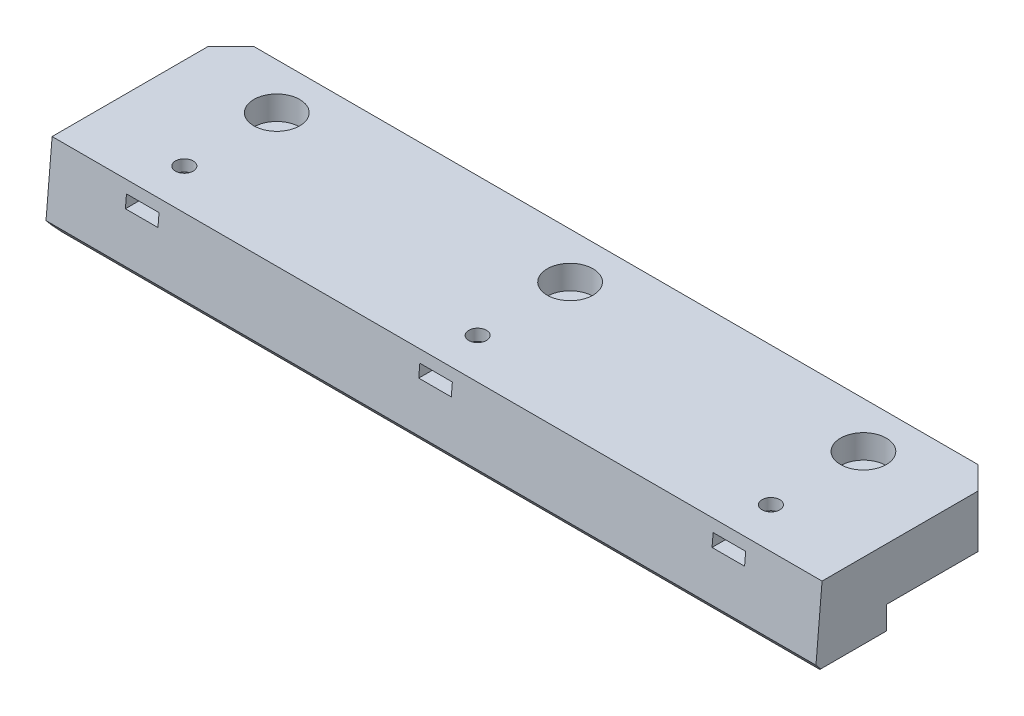
from build123d import *

# Parameters (mm, degrees)
SKETCH1_W             = 25.4
SKETCH1_H             = 9.525
BOSS_EXTRUDE1_DEPTH   = 106.68
BOSS_EXTRUDE2_DEPTH   = 213.36
CHAMFER1_SIZE         = 6.35
CHAMFER2_SIZE         = 3.175
CHAMFER2_SIZE2        = 2.93072295
F_8_CLEARANCE_HOLE1_D = 4.9149
CHAMFER3_SIZE         = 1.5875
BOSS_EXTRUDE3_DEPTH   = 3.429
BOSS_EXTRUDE4_START   = 3.175
SKETCH6_W             = 15.367
SKETCH6_H             = 20.192862299
SKETCH6_R             = 2.45745
BOSS_EXTRUDE4_DEPTH   = 3.175
SKETCH7_R             = 6.35
BOSS_EXTRUDE5_DEPTH   = 6.604
CUT_EXTRUDE1_DEPTH    = 218.112793351


with BuildPart() as part:
    # Sketch1 → Boss-Extrude1 (new, symmetric)
    with BuildSketch(Plane(origin=(0, 0, 0), x_dir=(0, 0, -1), z_dir=(1, 0, 0))):
        Rectangle(SKETCH1_W, SKETCH1_H)
    extrude(amount=BOSS_EXTRUDE1_DEPTH, both=True)

    # Sketch2 → Boss-Extrude2 (add, through all)
    with BuildSketch(Plane.ZY.offset(106.68)):
        Polygon((12.7, 4.7625), (37.438033761, 4.7625), (38.828997162, -11.13628443), (12.7, -11.13628443), align=None)
    extrude(amount=-BOSS_EXTRUDE2_DEPTH)

    # Chamfer1
    chamfer1_edges = [part.edges().sort_by_distance(p)[0] for p in [
        (106.68, 0, -12.7),
        (106.68, -7.949392215, 12.7),
        (-106.68, -7.949392215, 12.7),
        (-106.68, 0, -12.7),
    ]]
    chamfer(chamfer1_edges, length=CHAMFER1_SIZE)

    # Chamfer2
    chamfer2_edges = [part.edges().sort_by_distance(p)[0] for p in [
        (0, -11.13628443, 38.828997162),
    ]]
    chamfer2_side = [part.faces().sort_by_distance(p)[0] for p in [
        (0, -3.186892215, 38.133515462),
    ]]
    chamfer(chamfer2_edges, length=CHAMFER2_SIZE, length2=CHAMFER2_SIZE2, reference=chamfer2_side[0])

    # #8 Clearance Hole1 (through all)
    with Locations(Plane(origin=(0, -11.13628443, 0), x_dir=(-1, 0, 0), z_dir=(0, -1, 0))):
        with Locations((-81.28, -25.62613884), (0, 0), (0, -25.62613884), (81.28, -25.62613884), (81.28, 0), (-81.28, 0)):
            Hole(F_8_CLEARANCE_HOLE1_D / 2)

    # Chamfer3
    chamfer3_edges = [part.edges().sort_by_distance(p)[0] for p in [
        (0, -11.13628443, 12.7),
        (-106.68, -11.13628443, 27.474137106),
        (106.68, -11.13628443, 27.474137106),
        (-103.505, -11.13628443, 15.875),
        (103.505, -11.13628443, 15.875),
        (0, -4.7625, -12.7),
        (-103.505, -4.7625, -9.525),
        (103.505, -4.7625, -9.525),
        (-106.68, -4.7625, 6.35),
        (106.68, -4.7625, 6.35),
    ]]
    chamfer(chamfer3_edges, length=CHAMFER3_SIZE)

    # Sketch5 → Boss-Extrude3 (add)
    with BuildSketch(Plane(origin=(0, 4.7625, 0), x_dir=(1, 0, 0), z_dir=(0, 1, 0))):
        Polygon((85.7885, -37.438033761), (85.7885, -23.023155151), (81.28, -20.420171462), (76.7715, -23.023155151), (76.7715, -37.438033761), (73.5965, -37.438033761), (73.5965, -17.245171462), (88.9635, -17.245171462), (88.9635, -37.438033761), align=None)
        Polygon((4.5085, -37.438033761), (4.5085, -23.023155151), (0, -20.420171462), (-4.5085, -23.023155151), (-4.5085, -37.438033761), (-7.6835, -37.438033761), (-7.6835, -17.245171462), (7.6835, -17.245171462), (7.6835, -37.438033761), align=None)
        Polygon((-76.7715, -37.438033761), (-76.7715, -23.023155151), (-81.28, -20.420171462), (-85.7885, -23.023155151), (-85.7885, -37.438033761), (-88.9635, -37.438033761), (-88.9635, -17.245171462), (-73.5965, -17.245171462), (-73.5965, -37.438033761), align=None)
    extrude(amount=BOSS_EXTRUDE3_DEPTH)

    # Sketch6 → Boss-Extrude4 (add)
    # profile 1 of 3: a face of its own
    with BuildSketch(Plane(origin=(0, 8.1915, 0), x_dir=(1, 0, 0), z_dir=(0, 1, 0)).offset(BOSS_EXTRUDE4_START)):
        with Locations((-81.28, -27.341602612)):
            Rectangle(SKETCH6_W, SKETCH6_H)
        with Locations(Location((-81.28, -25.62613884, 0), (0, 0, 90))):
            Circle(SKETCH6_R, mode=Mode.SUBTRACT)
    # profile 2 of 3: a face of its own
    with BuildSketch(Plane(origin=(0, 8.1915, 0), x_dir=(1, 0, 0), z_dir=(0, 1, 0)).offset(BOSS_EXTRUDE4_START)):
        with Locations((0, -27.341602612)):
            Rectangle(SKETCH6_W, SKETCH6_H)
        with Locations(Location((0, -25.62613884, 0), (0, 0, 90))):
            Circle(SKETCH6_R, mode=Mode.SUBTRACT)
    # profile 3 of 3: a face of its own
    with BuildSketch(Plane(origin=(0, 8.1915, 0), x_dir=(1, 0, 0), z_dir=(0, 1, 0)).offset(BOSS_EXTRUDE4_START)):
        with Locations((81.28, -27.341602612)):
            Rectangle(SKETCH6_W, SKETCH6_H)
        with Locations(Location((81.28, -25.62613884, 0), (0, 0, 90))):
            Circle(SKETCH6_R, mode=Mode.SUBTRACT)
    extrude(amount=-BOSS_EXTRUDE4_DEPTH)

    # Sketch7 → Boss-Extrude5 (add)
    with BuildSketch(Plane(origin=(0, 4.7625, 0), x_dir=(1, 0, 0), z_dir=(0, 1, 0))):
        Polygon((-73.5965, -17.245171462), (-73.5965, -37.438033761), (-7.6835, -37.438033761), (-7.6835, -17.245171462), (7.6835, -17.245171462), (7.6835, -37.438033761), (73.5965, -37.438033761), (73.5965, -17.245171462), (88.9635, -17.245171462), (88.9635, -37.438033761), (106.68, -37.438033761), (106.68, 6.35), (100.33, 12.7), (-100.33, 12.7), (-106.68, 6.35), (-106.68, -37.438033761), (-88.9635, -37.438033761), (-88.9635, -17.245171462), align=None)
        with Locations(Location((81.28, 0, 0), (0, 0, 90))):
            Circle(SKETCH7_R, mode=Mode.SUBTRACT)
        with Locations(Location((0, 0, 0), (0, 0, 90))):
            Circle(SKETCH7_R, mode=Mode.SUBTRACT)
        with Locations(Location((-81.28, 0, 0), (0, 0, 90))):
            Circle(SKETCH7_R, mode=Mode.SUBTRACT)
    extrude(amount=BOSS_EXTRUDE5_DEPTH)

    # Sketch8 → Cut-Extrude1 (cut, through all)
    with BuildSketch(Plane.ZY.offset(106.68)):
        Polygon((37.438033761, 4.7625), (36.860258627, 11.3665), (37.438033761, 11.3665), align=None)
    extrude(amount=-CUT_EXTRUDE1_DEPTH, mode=Mode.SUBTRACT)


solid = part.part
